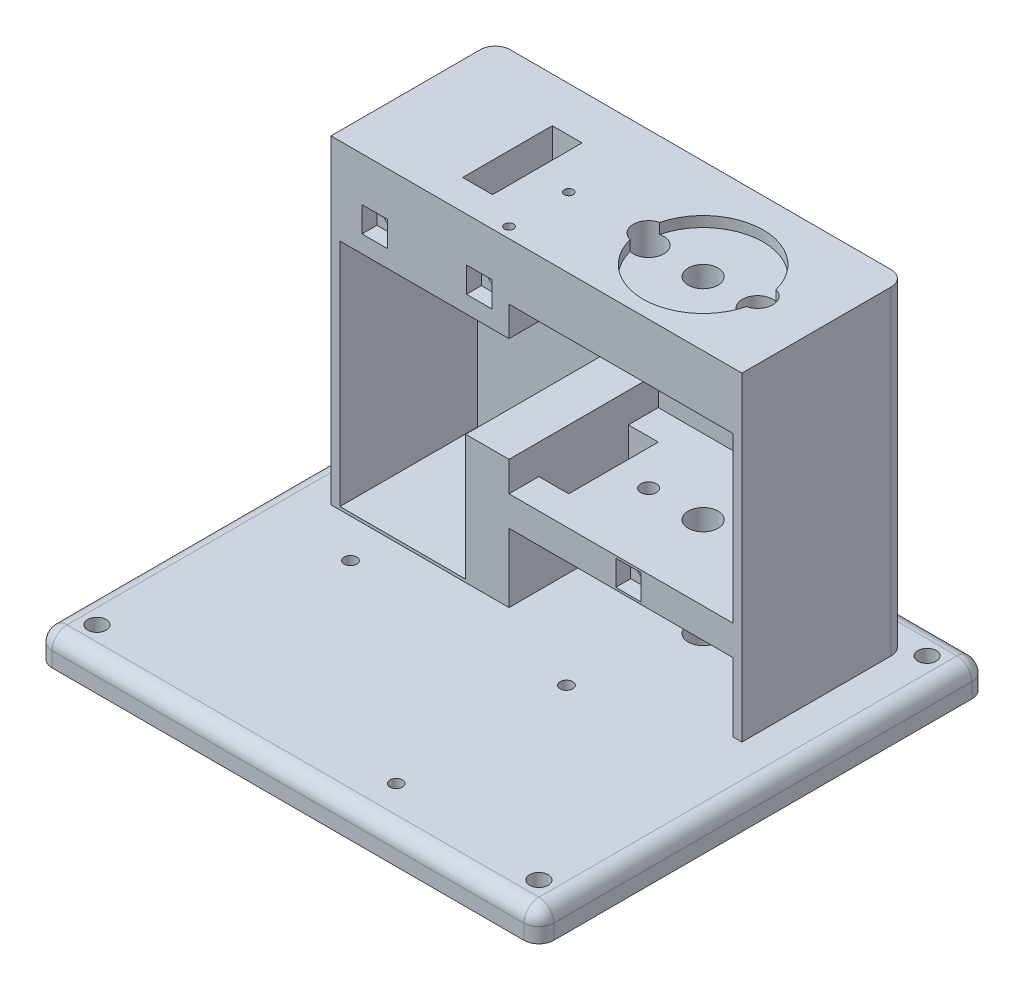
from build123d import *

# Parameters (mm, degrees)
SKETCH1_W                = 150
SKETCH1_H                = 120
BOSS_EXTRUDE2_DEPTH      = 70
BOSS_EXTRUDE5_DEPTH      = 3
BOSS_EXTRUDE5_DEPTH_BACK = 7
SKETCH4_W                = 168
SKETCH4_H                = 150
SKETCH6_R                = 3.1
CUT_EXTRUDE1_DEPTH       = 20
FILLET2_R                = 5
SKETCH2_R                = 20.1
CUT_EXTRUDE2_DEPTH       = 9.5
SKETCH9_R                = 5
CUT_EXTRUDE5_DEPTH       = 20
SKETCH15_W               = 167.384372829
SKETCH15_H               = 135.598337876
CUT_EXTRUDE12_DEPTH      = 10
SKETCH16_W               = 75
SKETCH16_H               = 88
CUT_EXTRUDE13_DEPTH      = 50
BOSS_EXTRUDE6_START      = 55
SKETCH18_W               = 75
SKETCH18_H               = 50
BOSS_EXTRUDE6_DEPTH      = 10
CUT_EXTRUDE14_START      = -25
SKETCH17_R               = 5.1
CUT_EXTRUDE14_DEPTH      = 17
CUT_EXTRUDE15_START      = -25
SKETCH17_3_R             = 2.6
CUT_EXTRUDE15_DEPTH      = 90
SKETCH19_W               = 50
SKETCH19_H               = 35
CUT_EXTRUDE19_DEPTH      = 56.62
CUT_EXTRUDE20_DEPTH      = 46
CUT_EXTRUDE21_START      = -60
SKETCH21_R               = 2
CUT_EXTRUDE21_DEPTH      = 25
SKETCH9_4_R              = 5
CUT_EXTRUDE24_DEPTH      = 150
CUT_EXTRUDE25_START      = -10
SKETCH22_W               = 10
SKETCH22_H               = 30
CUT_EXTRUDE25_DEPTH      = 29
SKETCH23_R               = 2.1
CUT_EXTRUDE26_DEPTH      = 243.458243828
CUT_EXTRUDE27_START      = -10
SKETCH23_3_R             = 4
CUT_EXTRUDE27_DEPTH      = 5
SKETCH24_R               = 1.5
CUT_EXTRUDE28_DEPTH      = 30
SKETCH25_W               = 10
SKETCH25_H               = 30
CUT_EXTRUDE29_DEPTH      = 40
CUT_EXTRUDE30_DEPTH      = 196
CUT_EXTRUDE32_DEPTH      = 196
CUT_EXTRUDE33_START      = -3
SKETCH30_W               = 8.52
SKETCH30_H               = 40
CUT_EXTRUDE33_DEPTH      = 37
FILLET3_R                = 5
CUT_EXTRUDE34_START      = -3
SKETCH31_W               = 5.550839789
SKETCH31_H               = 10.134989035
SKETCH31_W_2             = 14.692790928
SKETCH31_H_2             = 12.94032263
CUT_EXTRUDE34_DEPTH      = 49
SKETCH32_W               = 8.5
SKETCH32_H               = 8.5
CUT_EXTRUDE37_DEPTH      = 5


with BuildPart() as part:
    # Sketch1 → Boss-Extrude2 (new body)
    with BuildSketch(Plane.XY):
        with Locations((75, 60)):
            Rectangle(SKETCH1_W, SKETCH1_H)
    extrude(amount=BOSS_EXTRUDE2_DEPTH)

    # Sketch4 → Boss-Extrude5 (add, two sides: drawn at the far end of the back side and taken through both)
    with BuildSketch(Plane.XZ.offset(-BOSS_EXTRUDE5_DEPTH_BACK)):
        with Locations((75, 69)):
            Rectangle(SKETCH4_W, SKETCH4_H)
    extrude(amount=BOSS_EXTRUDE5_DEPTH + BOSS_EXTRUDE5_DEPTH_BACK)

    # Sketch6 → Cut-Extrude1 (cut)
    with BuildSketch(Plane.XZ.offset(3)):
        with Locations((1, 134)):
            Circle(SKETCH6_R)
        with Locations((149, 134)):
            Circle(SKETCH6_R)
        with Locations((149, 4)):
            Circle(SKETCH6_R)
        with Locations((1, 4)):
            Circle(SKETCH6_R)
    extrude(amount=-CUT_EXTRUDE1_DEPTH, mode=Mode.SUBTRACT)

    # Fillet2
    fillet2_edges = [part.edges().sort_by_distance(p)[0] for p in [
        (-9, 2, -6),
        (-9, 7, 69),
        (-9, 2, 144),
        (75, 7, 144),
        (159, 2, 144),
        (159, 7, 69),
        (159, 2, -6),
        (75, 7, -6),
    ]]
    fillet(fillet2_edges, radius=FILLET2_R)

    # Sketch2 → Cut-Extrude2 (cut)
    with BuildSketch(Plane(origin=(0, 120, 0), x_dir=(1, 0, 0), z_dir=(0, 1, 0))):
        with Locations(Location((105, -35, 0), (0, 0, 270))):
            Circle(SKETCH2_R)
    extrude(amount=-CUT_EXTRUDE2_DEPTH, mode=Mode.SUBTRACT)

    # Sketch9 → Cut-Extrude5 (cut)
    with BuildSketch(Plane(origin=(0, 110.5, 0), x_dir=(1, 0, 0), z_dir=(0, 1, 0))):
        with Locations(Location((105, -35, 0), (0, 0, 270))):
            Circle(SKETCH9_R)
    extrude(amount=-CUT_EXTRUDE5_DEPTH, mode=Mode.SUBTRACT)

    # Sketch15 → Cut-Extrude12 (cut)
    with BuildSketch(Plane.XY.offset(70)):
        with Locations((79.692186415, 74.799168938)):
            Rectangle(SKETCH15_W, SKETCH15_H)
    extrude(amount=-CUT_EXTRUDE12_DEPTH, mode=Mode.SUBTRACT)

    # Sketch16 → Cut-Extrude13 (cut)
    with BuildSketch(Plane.XY.offset(60)):
        with Locations((102.5, 51)):
            Rectangle(SKETCH16_W, SKETCH16_H)
    extrude(amount=-CUT_EXTRUDE13_DEPTH, mode=Mode.SUBTRACT)

    # Sketch18 → Boss-Extrude6 (add)
    with BuildSketch(Plane.XZ.offset(-95).offset(BOSS_EXTRUDE6_START)):
        with Locations((102.5, 35)):
            Rectangle(SKETCH18_W, SKETCH18_H)
    extrude(amount=BOSS_EXTRUDE6_DEPTH)

    # Sketch17 → Cut-Extrude14 (cut)
    with BuildSketch(Plane.XZ.offset(-95).offset(CUT_EXTRUDE14_START)):
        with Locations(Location((123.25, 35, 0), (0, 0, 76.030533487))):
            Circle(SKETCH17_R)
        with Locations(Location((86.75, 35, 0), (0, 0, 103.969466513))):
            Circle(SKETCH17_R)
    extrude(amount=CUT_EXTRUDE14_DEPTH, mode=Mode.SUBTRACT)

    # Sketch17<3> → Cut-Extrude15 (cut)
    with BuildSketch(Plane.XZ.offset(-95).offset(CUT_EXTRUDE15_START)):
        with Locations(Location((123.25, 35, 0), (0, 0, 90))):
            Circle(SKETCH17_3_R)
        with Locations(Location((86.75, 35, 0), (0, 0, 90))):
            Circle(SKETCH17_3_R)
    extrude(amount=CUT_EXTRUDE15_DEPTH, mode=Mode.SUBTRACT)

    # Sketch19 → Cut-Extrude19 (cut)
    with BuildSketch(Plane(origin=(65, 0, 0), x_dir=(0, 0, -1), z_dir=(1, 0, 0))):
        with Locations((-35, 67.5)):
            Rectangle(SKETCH19_W, SKETCH19_H)
    extrude(amount=-CUT_EXTRUDE19_DEPTH, mode=Mode.SUBTRACT)

    # Sketch20 → Cut-Extrude20 (cut)
    with BuildSketch(Plane.XY.offset(60)):
        Polygon((8.38, 8), (50.48, 8), (50.48, 58), (33.43, 58), (33.43, 83), (25.43, 83), (25.43, 58), (8.38, 58), align=None)
    extrude(amount=-CUT_EXTRUDE20_DEPTH, mode=Mode.SUBTRACT)

    # Sketch21 → Cut-Extrude21 (cut)
    with BuildSketch(Plane(origin=(0, 0, 0), x_dir=(-1, 0, 0), z_dir=(0, 0, -1)).offset(CUT_EXTRUDE21_START)):
        with Locations((-20, 95)):
            Circle(SKETCH21_R)
        with Locations((-105, 35)):
            Circle(SKETCH21_R)
        with Locations((-55, 95)):
            Circle(SKETCH21_R)
    extrude(amount=CUT_EXTRUDE21_DEPTH, mode=Mode.SUBTRACT)

    # Sketch9<4> → Cut-Extrude24 (cut)
    with BuildSketch(Plane(origin=(0, 110.5, 0), x_dir=(1, 0, 0), z_dir=(0, 1, 0))):
        with Locations(Location((105, -35, 0), (0, 0, 270))):
            Circle(SKETCH9_4_R)
    extrude(amount=-CUT_EXTRUDE24_DEPTH, mode=Mode.SUBTRACT)

    # Sketch22 → Cut-Extrude25 (cut)
    with BuildSketch(Plane(origin=(0, 40, 0), x_dir=(1, 0, 0), z_dir=(0, 1, 0)).offset(CUT_EXTRUDE25_START)):
        with Locations((70, -35)):
            Rectangle(SKETCH22_W, SKETCH22_H)
    extrude(amount=CUT_EXTRUDE25_DEPTH, mode=Mode.SUBTRACT)

    # Sketch23 → Cut-Extrude26 (cut, through all)
    with BuildSketch(Plane(origin=(0, 7, 0), x_dir=(1, 0, 0), z_dir=(0, 1, 0))):
        with Locations(Location((24.822097221, -72.904396363, 0), (0, 0, 180))):
            Circle(SKETCH23_R)
        with Locations(Location((97.135530056, -72.904396363, 0), (0, 0, 180))):
            Circle(SKETCH23_R)
        with Locations(Location((97.135530056, -129.904396363, 0), (0, 0, 180))):
            Circle(SKETCH23_R)
    extrude(amount=-CUT_EXTRUDE26_DEPTH, mode=Mode.SUBTRACT)

    # Sketch23<3> → Cut-Extrude27 (cut)
    with BuildSketch(Plane(origin=(0, 7, 0), x_dir=(1, 0, 0), z_dir=(0, 1, 0)).offset(CUT_EXTRUDE27_START)):
        with Locations(Location((24.822097221, -72.904396363, 0), (0, 0, 180))):
            Circle(SKETCH23_3_R)
        with Locations(Location((97.135530056, -72.904396363, 0), (0, 0, 180))):
            Circle(SKETCH23_3_R)
        with Locations(Location((97.135530056, -129.904396363, 0), (0, 0, 180))):
            Circle(SKETCH23_3_R)
    extrude(amount=CUT_EXTRUDE27_DEPTH, mode=Mode.SUBTRACT)

    # Sketch24 → Cut-Extrude28 (cut)
    with BuildSketch(Plane(origin=(0, 120, 0), x_dir=(1, 0, 0), z_dir=(0, 1, 0))):
        with Locations(Location((61.5, -36.5, 0), (0, 0, 270))):
            Circle(SKETCH24_R)
        with Locations(Location((61.5, -56.5, 0), (0, 0, 270))):
            Circle(SKETCH24_R)
    extrude(amount=-CUT_EXTRUDE28_DEPTH, mode=Mode.SUBTRACT)

    # Sketch25 → Cut-Extrude29 (cut)
    with BuildSketch(Plane(origin=(0, 120, 0), x_dir=(1, 0, 0), z_dir=(0, 1, 0))):
        with Locations((44.48, -35)):
            Rectangle(SKETCH25_W, SKETCH25_H)
    extrude(amount=-CUT_EXTRUDE29_DEPTH, mode=Mode.SUBTRACT)

    # Sketch27 → Cut-Extrude30 (cut)
    with BuildSketch(Plane.XY.offset(60)):
        Polygon((143, 114), (5.38, 114), (5.38, 7), (-15.039720256, 7), (-15.039720256, 109), (-15.039720256, 126.65195416), (160.466879019, 126.65195416), (160.466879019, 109), (160.466879019, 7), (143, 7), align=None)
    extrude(amount=-CUT_EXTRUDE30_DEPTH, mode=Mode.SUBTRACT)

    # Sketch29 → Cut-Extrude32 (cut)
    with BuildSketch(Plane.ZY.offset(-5.38)):
        Polygon((-8.937501462, 135.391592563), (5, 135.391592563), (5, 7), (-13.483359674, 7), align=None)
    extrude(amount=-CUT_EXTRUDE32_DEPTH, mode=Mode.SUBTRACT)

    # Sketch30 → Cut-Extrude33 (cut)
    with BuildSketch(Plane(origin=(0, 50, 0), x_dir=(1, 0, 0), z_dir=(0, 1, 0)).offset(CUT_EXTRUDE33_START)):
        with Locations((57.74, -37)):
            Rectangle(SKETCH30_W, SKETCH30_H)
    extrude(amount=-CUT_EXTRUDE33_DEPTH, mode=Mode.SUBTRACT)

    # Fillet3
    fillet3_edges = [part.edges().sort_by_distance(p)[0] for p in [
        (143, 60.5, 5),
        (5.38, 60.5, 5),
    ]]
    fillet(fillet3_edges, radius=FILLET3_R)

    # Sketch31 → Cut-Extrude34 (cut)
    with BuildSketch(Plane.XY.offset(60).offset(CUT_EXTRUDE34_START)):
        Polygon((37.902832863, 110.401622614), (25.54931853, 110.401622614), (13.735368308, 110.401622614), (13.735368308, 100.155334019), (25.54931853, 100.155334019), (25.54931853, 87.423968607), (37.902832863, 87.423968607), align=None)
        with Locations((55.5860526, 105.941968642)):
            Rectangle(SKETCH31_W, SKETCH31_H)
        with Locations((73.077247019, 104.554579716)):
            Rectangle(SKETCH31_W_2, SKETCH31_H_2)
    extrude(amount=-CUT_EXTRUDE34_DEPTH, mode=Mode.SUBTRACT)

    # Sketch32 → Cut-Extrude37 (cut)
    with BuildSketch(Plane.XY.offset(60)):
        with Locations((20, 95)):
            Rectangle(SKETCH32_W, SKETCH32_H)
        with Locations((55, 95)):
            Rectangle(SKETCH32_W, SKETCH32_H)
        with Locations((105, 35)):
            Rectangle(SKETCH32_W, SKETCH32_H)
    extrude(amount=-CUT_EXTRUDE37_DEPTH, mode=Mode.SUBTRACT)


solid = part.part
